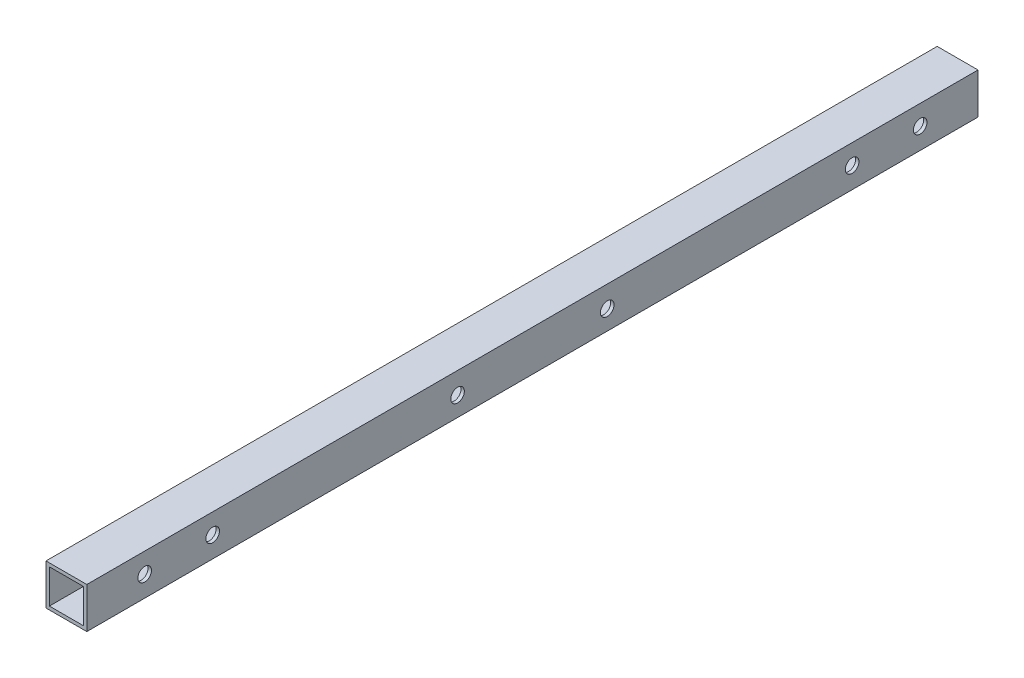
from build123d import *

# Parameters (mm, degrees)
BOSS_EXTRUDE1_START = -34.925
SKETCH1_W           = 38.1
SKETCH1_H           = 38.1
SKETCH1_W_2         = 31.75
SKETCH1_H_2         = 31.75
BOSS_EXTRUDE1_DEPTH = 831.85
SKETCH2_R           = 6.35
CUT_EXTRUDE1_DEPTH  = 799.062634212


with BuildPart() as part:
    # Sketch1 → Boss-Extrude1 (new body)
    with BuildSketch(Plane.XY.offset(BOSS_EXTRUDE1_START)):
        Rectangle(SKETCH1_W, SKETCH1_H)
        Rectangle(SKETCH1_W_2, SKETCH1_H_2, mode=Mode.SUBTRACT)
    extrude(amount=BOSS_EXTRUDE1_DEPTH)

    # Sketch2 → Cut-Extrude1 (cut, through all)
    with BuildSketch(Plane(origin=(19.05, 0, 0), x_dir=(0, 0, -1), z_dir=(1, 0, 0))):
        with Locations((-311.15, -0.905146159)):
            Circle(SKETCH2_R)
        with Locations((-450.85, -0.905146159)):
            Circle(SKETCH2_R)
        with Locations((-679.45, 0.347280154)):
            Circle(SKETCH2_R)
        with Locations((-742.95, 0.347280154)):
            Circle(SKETCH2_R)
        with Locations((-82.55, 0.541693979)):
            Circle(SKETCH2_R)
        with Locations((-19.05, 0.541693979)):
            Circle(SKETCH2_R)
    extrude(amount=-CUT_EXTRUDE1_DEPTH, mode=Mode.SUBTRACT)


solid = part.part
